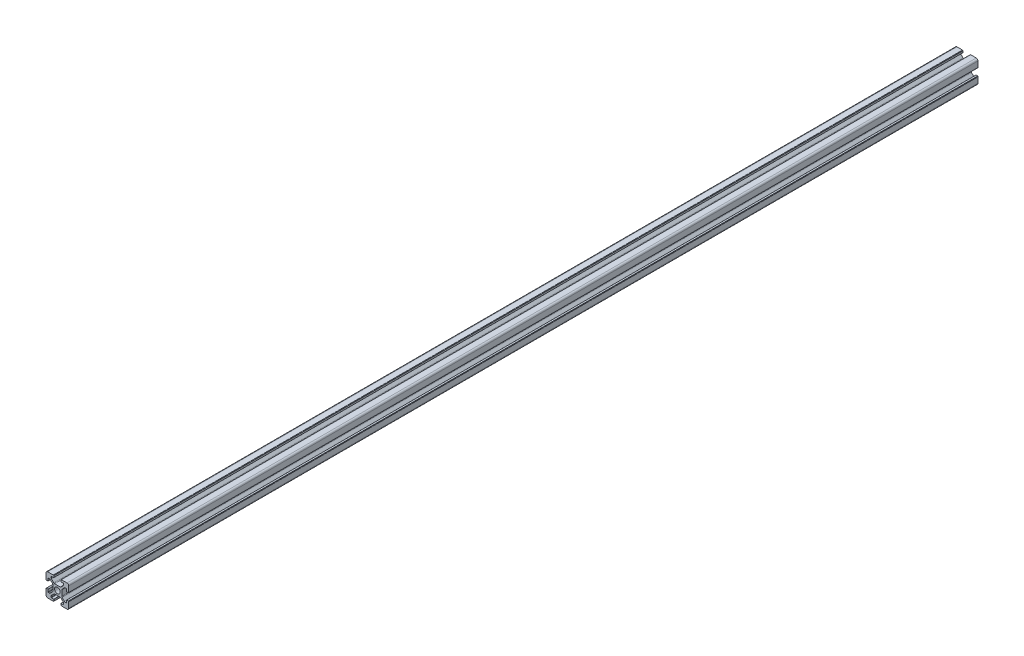
from build123d import *

# Parameters (mm, degrees)
SKETCH_1_R      = 2.5
EXTRUDE_1_DEPTH = 800
FILLET_1_R      = 1.5


with BuildPart() as part:
    # 草图1 → 凸台-拉伸1 (new body)
    with BuildSketch(Plane.XY):
        with BuildLine():
            Line((20, 13.6), (20, 20))
            Line((20, 20), (13.6, 20))
            Line((13.6, 20), (13.6, 19.8))
            Line((13.6, 19.8), (13.2, 19.8))
            ThreePointArc((13.2, 19.8), (13.129289322, 19.770710678), (13.1, 19.7))
            Line((13.1, 19.7), (13.1, 18.3))
            ThreePointArc((13.1, 18.3), (13.129289322, 18.229289322), (13.2, 18.2))
            Line((13.2, 18.2), (15.2, 18.2))
            ThreePointArc((15.2, 18.2), (15.412132034, 18.112132034), (15.5, 17.9))
            Line((15.5, 17.9), (15.5, 16.974873734))
            ThreePointArc((15.5, 16.974873734), (15.423879533, 16.592190302), (15.207106781, 16.267766953))
            Line((15.207106781, 16.267766953), (13.132233047, 14.192893219))
            ThreePointArc((13.132233047, 14.192893219), (12.807809698, 13.976120467), (12.425126266, 13.9))
            Line((12.425126266, 13.9), (7.574873734, 13.9))
            ThreePointArc((7.574873734, 13.9), (7.192190302, 13.976120467), (6.867766953, 14.192893219))
            Line((6.867766953, 14.192893219), (4.792893219, 16.267766953))
            ThreePointArc((4.792893219, 16.267766953), (4.576120467, 16.592190302), (4.5, 16.974873734))
            Line((4.5, 16.974873734), (4.5, 17.9))
            ThreePointArc((4.5, 17.9), (4.587867966, 18.112132034), (4.8, 18.2))
            Line((4.8, 18.2), (6.8, 18.2))
            ThreePointArc((6.8, 18.2), (6.870710678, 18.229289322), (6.9, 18.3))
            Line((6.9, 18.3), (6.9, 19.7))
            ThreePointArc((6.9, 19.7), (6.870710678, 19.770710678), (6.8, 19.8))
            Line((6.8, 19.8), (6.4, 19.8))
            Line((6.4, 19.8), (6.4, 20))
            Line((6.4, 20), (0, 20))
            Line((0, 20), (0, 13.6))
            Line((0, 13.6), (0.2, 13.6))
            Line((0.2, 13.6), (0.2, 13.2))
            ThreePointArc((0.2, 13.2), (0.229289322, 13.129289322), (0.3, 13.1))
            Line((0.3, 13.1), (1.7, 13.1))
            ThreePointArc((1.7, 13.1), (1.770710678, 13.129289322), (1.8, 13.2))
            Line((1.8, 13.2), (1.8, 15.2))
            ThreePointArc((1.8, 15.2), (1.887867966, 15.412132034), (2.1, 15.5))
            Line((2.1, 15.5), (3.025126266, 15.5))
            ThreePointArc((3.025126266, 15.5), (3.407809698, 15.423879533), (3.732233047, 15.207106781))
            Line((3.732233047, 15.207106781), (5.807106781, 13.132233047))
            ThreePointArc((5.807106781, 13.132233047), (6.023879533, 12.807809698), (6.1, 12.425126266))
            Line((6.1, 12.425126266), (6.1, 7.574873734))
            ThreePointArc((6.1, 7.574873734), (6.023879533, 7.192190302), (5.807106781, 6.867766953))
            Line((5.807106781, 6.867766953), (3.732233047, 4.792893219))
            ThreePointArc((3.732233047, 4.792893219), (3.407809698, 4.576120467), (3.025126266, 4.5))
            Line((3.025126266, 4.5), (2.1, 4.5))
            ThreePointArc((2.1, 4.5), (1.887867966, 4.587867966), (1.8, 4.8))
            Line((1.8, 4.8), (1.8, 6.8))
            ThreePointArc((1.8, 6.8), (1.770710678, 6.870710678), (1.7, 6.9))
            Line((1.7, 6.9), (0.3, 6.9))
            ThreePointArc((0.3, 6.9), (0.229289322, 6.870710678), (0.2, 6.8))
            Line((0.2, 6.8), (0.2, 6.4))
            Line((0.2, 6.4), (0, 6.4))
            Line((0, 6.4), (0, 0))
            Line((0, 0), (6.4, 0))
            Line((6.4, 0), (6.4, 0.2))
            Line((6.4, 0.2), (6.8, 0.2))
            ThreePointArc((6.8, 0.2), (6.870710678, 0.229289322), (6.9, 0.3))
            Line((6.9, 0.3), (6.9, 1.7))
            ThreePointArc((6.9, 1.7), (6.870710678, 1.770710678), (6.8, 1.8))
            Line((6.8, 1.8), (4.8, 1.8))
            ThreePointArc((4.8, 1.8), (4.587867966, 1.887867966), (4.5, 2.1))
            Line((4.5, 2.1), (4.5, 3.025126266))
            ThreePointArc((4.5, 3.025126266), (4.576120467, 3.407809698), (4.792893219, 3.732233047))
            Line((4.792893219, 3.732233047), (6.867766953, 5.807106781))
            ThreePointArc((6.867766953, 5.807106781), (7.192190302, 6.023879533), (7.574873734, 6.1))
            Line((7.574873734, 6.1), (12.425126266, 6.1))
            ThreePointArc((12.425126266, 6.1), (12.807809698, 6.023879533), (13.132233047, 5.807106781))
            Line((13.132233047, 5.807106781), (15.207106781, 3.732233047))
            ThreePointArc((15.207106781, 3.732233047), (15.423879533, 3.407809698), (15.5, 3.025126266))
            Line((15.5, 3.025126266), (15.5, 2.1))
            ThreePointArc((15.5, 2.1), (15.412132034, 1.887867966), (15.2, 1.8))
            Line((15.2, 1.8), (13.2, 1.8))
            ThreePointArc((13.2, 1.8), (13.129289322, 1.770710678), (13.1, 1.7))
            Line((13.1, 1.7), (13.1, 0.3))
            ThreePointArc((13.1, 0.3), (13.129289322, 0.229289322), (13.2, 0.2))
            Line((13.2, 0.2), (13.6, 0.2))
            Line((13.6, 0.2), (13.6, 0))
            Line((13.6, 0), (20, 0))
            Line((20, 0), (20, 6.4))
            Line((20, 6.4), (19.8, 6.4))
            Line((19.8, 6.4), (19.8, 6.8))
            ThreePointArc((19.8, 6.8), (19.770710678, 6.870710678), (19.7, 6.9))
            Line((19.7, 6.9), (18.3, 6.9))
            ThreePointArc((18.3, 6.9), (18.229289322, 6.870710678), (18.2, 6.8))
            Line((18.2, 6.8), (18.2, 4.8))
            ThreePointArc((18.2, 4.8), (18.112132034, 4.587867966), (17.9, 4.5))
            Line((17.9, 4.5), (16.974873734, 4.5))
            ThreePointArc((16.974873734, 4.5), (16.592190302, 4.576120467), (16.267766953, 4.792893219))
            Line((16.267766953, 4.792893219), (14.192893219, 6.867766953))
            ThreePointArc((14.192893219, 6.867766953), (13.976120467, 7.192190302), (13.9, 7.574873734))
            Line((13.9, 7.574873734), (13.9, 12.425126266))
            ThreePointArc((13.9, 12.425126266), (13.976120467, 12.807809698), (14.192893219, 13.132233047))
            Line((14.192893219, 13.132233047), (16.267766953, 15.207106781))
            ThreePointArc((16.267766953, 15.207106781), (16.592190302, 15.423879533), (16.974873734, 15.5))
            Line((16.974873734, 15.5), (17.9, 15.5))
            ThreePointArc((17.9, 15.5), (18.112132034, 15.412132034), (18.2, 15.2))
            Line((18.2, 15.2), (18.2, 13.2))
            ThreePointArc((18.2, 13.2), (18.229289322, 13.129289322), (18.3, 13.1))
            Line((18.3, 13.1), (19.7, 13.1))
            ThreePointArc((19.7, 13.1), (19.770710678, 13.129289322), (19.8, 13.2))
            Line((19.8, 13.2), (19.8, 13.6))
            Line((19.8, 13.6), (20, 13.6))
        make_face()
        with Locations((10, 10)):
            Circle(SKETCH_1_R, mode=Mode.SUBTRACT)
    extrude(amount=EXTRUDE_1_DEPTH)

    # 圆角1
    fillet_1_edges = [part.edges().sort_by_distance(p)[0] for p in [
        (0, 0, 400),
        (0, 20, 400),
        (20, 20, 400),
        (20, 0, 400),
    ]]
    fillet(fillet_1_edges, radius=FILLET_1_R)


solid = part.part
